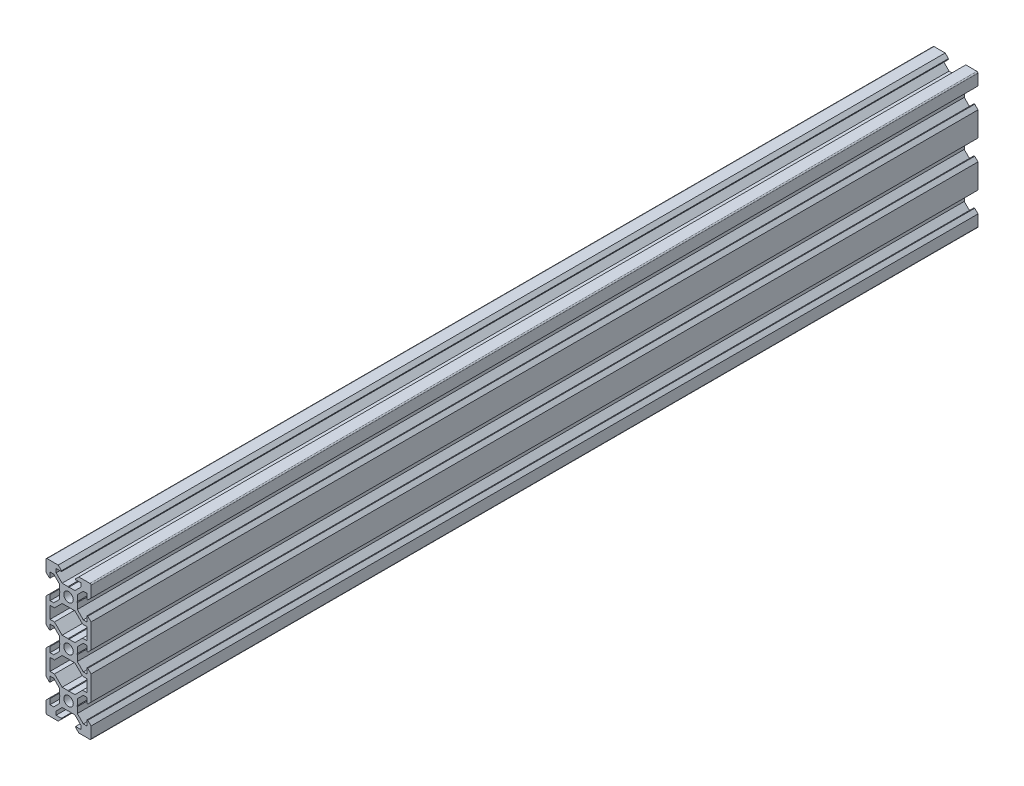
from build123d import *

# Parameters (mm, degrees)
BOSS_EXTRU_1_DEPTH = 393.7


with BuildPart() as part:
    # Esquisse1 → Boss.-Extru.1 (new body)
    with BuildSketch(Plane.XY):
        with BuildLine():
            Line((-9.5, 10), (-4.58, 10))
            Line((-4.58, 10), (-3.125, 8.545))
            Line((-3.125, 8.545), (-3.125, 8.2))
            Line((-3.125, 8.2), (-5.5, 8.2))
            Line((-5.5, 8.2), (-5.5, 6.560660172))
            Line((-5.5, 6.560660172), (-2.839339828, 3.9))
            Line((-2.839339828, 3.9), (-0.21, 3.9))
            Line((-0.21, 3.9), (0, 3.69))
            Line((0, 3.69), (0, 2.1))
            ThreePointArc((0, 2.1), (-2.1, 0), (0, -2.1))
            Line((0, -2.1), (0, -3.69))
            Line((0, -3.69), (-0.21, -3.9))
            Line((-0.21, -3.9), (-2.839339828, -3.9))
            Line((-2.839339828, -3.9), (-6.239339828, -7.3))
            Line((-6.239339828, -7.3), (-8.2, -7.3))
            Line((-8.2, -7.3), (-8.2, -12.7))
            Line((-8.2, -12.7), (-6.239339828, -12.7))
            Line((-6.239339828, -12.7), (-2.839339828, -16.1))
            Line((-2.839339828, -16.1), (-0.21, -16.1))
            Line((-0.21, -16.1), (0, -16.31))
            Line((0, -16.31), (0, -17.9))
            ThreePointArc((0, -17.9), (-2.1, -20), (0, -22.1))
            Line((0, -22.1), (0, -23.69))
            Line((0, -23.69), (-0.21, -23.9))
            Line((-0.21, -23.9), (-2.839339828, -23.9))
            Line((-2.839339828, -23.9), (-6.239339828, -27.3))
            Line((-6.239339828, -27.3), (-8.2, -27.3))
            Line((-8.2, -27.3), (-8.2, -32.7))
            Line((-8.2, -32.7), (-6.239339828, -32.7))
            Line((-6.239339828, -32.7), (-2.839339828, -36.1))
            Line((-2.839339828, -36.1), (-0.21, -36.1))
            Line((-0.21, -36.1), (0, -36.31))
            Line((0, -36.31), (0, -37.9))
            ThreePointArc((0, -37.9), (-2.1, -40), (0, -42.1))
            Line((0, -42.1), (0, -43.69))
            Line((0, -43.69), (-0.21, -43.9))
            Line((-0.21, -43.9), (-2.839339828, -43.9))
            Line((-2.839339828, -43.9), (-5.5, -46.560660172))
            Line((-5.5, -46.560660172), (-5.5, -48.2))
            Line((-5.5, -48.2), (-3.125, -48.2))
            Line((-3.125, -48.2), (-3.125, -48.545))
            Line((-3.125, -48.545), (-4.58, -50))
            Line((-4.58, -50), (-9.5, -50))
            ThreePointArc((-9.5, -50), (-9.853553391, -49.853553391), (-10, -49.5))
            Line((-10, -49.5), (-10, -44.58))
            Line((-10, -44.58), (-8.545, -43.125))
            Line((-8.545, -43.125), (-8.2, -43.125))
            Line((-8.2, -43.125), (-8.2, -45.5))
            Line((-8.2, -45.5), (-6.560660172, -45.5))
            Line((-6.560660172, -45.5), (-3.9, -42.839339828))
            Line((-3.9, -42.839339828), (-3.9, -40.21))
            Line((-3.9, -40.21), (-3.69, -40))
            Line((-3.69, -40), (-3.9, -39.79))
            Line((-3.9, -39.79), (-3.9, -37.160660172))
            Line((-3.9, -37.160660172), (-6.560660172, -34.5))
            Line((-6.560660172, -34.5), (-8.2, -34.5))
            Line((-8.2, -34.5), (-8.2, -36.875))
            Line((-8.2, -36.875), (-8.545, -36.875))
            Line((-8.545, -36.875), (-10, -35.42))
            Line((-10, -35.42), (-10, -24.58))
            Line((-10, -24.58), (-8.545, -23.125))
            Line((-8.545, -23.125), (-8.2, -23.125))
            Line((-8.2, -23.125), (-8.2, -25.5))
            Line((-8.2, -25.5), (-6.560660172, -25.5))
            Line((-6.560660172, -25.5), (-3.9, -22.839339828))
            Line((-3.9, -22.839339828), (-3.9, -20.21))
            Line((-3.9, -20.21), (-3.69, -20))
            Line((-3.69, -20), (-3.9, -19.79))
            Line((-3.9, -19.79), (-3.9, -17.160660172))
            Line((-3.9, -17.160660172), (-6.560660172, -14.5))
            Line((-6.560660172, -14.5), (-8.2, -14.5))
            Line((-8.2, -14.5), (-8.2, -16.875))
            Line((-8.2, -16.875), (-8.545, -16.875))
            Line((-8.545, -16.875), (-10, -15.42))
            Line((-10, -15.42), (-10, -4.58))
            Line((-10, -4.58), (-8.545, -3.125))
            Line((-8.545, -3.125), (-8.2, -3.125))
            Line((-8.2, -3.125), (-8.2, -5.5))
            Line((-8.2, -5.5), (-6.560660172, -5.5))
            Line((-6.560660172, -5.5), (-3.9, -2.839339828))
            Line((-3.9, -2.839339828), (-3.9, -0.21))
            Line((-3.9, -0.21), (-3.69, 0))
            Line((-3.69, 0), (-3.9, 0.21))
            Line((-3.9, 0.21), (-3.9, 2.839339828))
            Line((-3.9, 2.839339828), (-6.560660172, 5.5))
            Line((-6.560660172, 5.5), (-8.2, 5.5))
            Line((-8.2, 5.5), (-8.2, 3.125))
            Line((-8.2, 3.125), (-8.545, 3.125))
            Line((-8.545, 3.125), (-10, 4.58))
            Line((-10, 4.58), (-10, 9.5))
            ThreePointArc((-10, 9.5), (-9.853553391, 9.853553391), (-9.5, 10))
        make_face()
    boss_extru_1 = extrude(amount=BOSS_EXTRU_1_DEPTH)

    # Symétrie1: Boss.-Extru.1 across plane
    add(boss_extru_1.mirror(Plane(origin=(0, 3.69, 393.7), x_dir=(0, 0, 1), z_dir=(-1, 0, 0))))


solid = part.part
